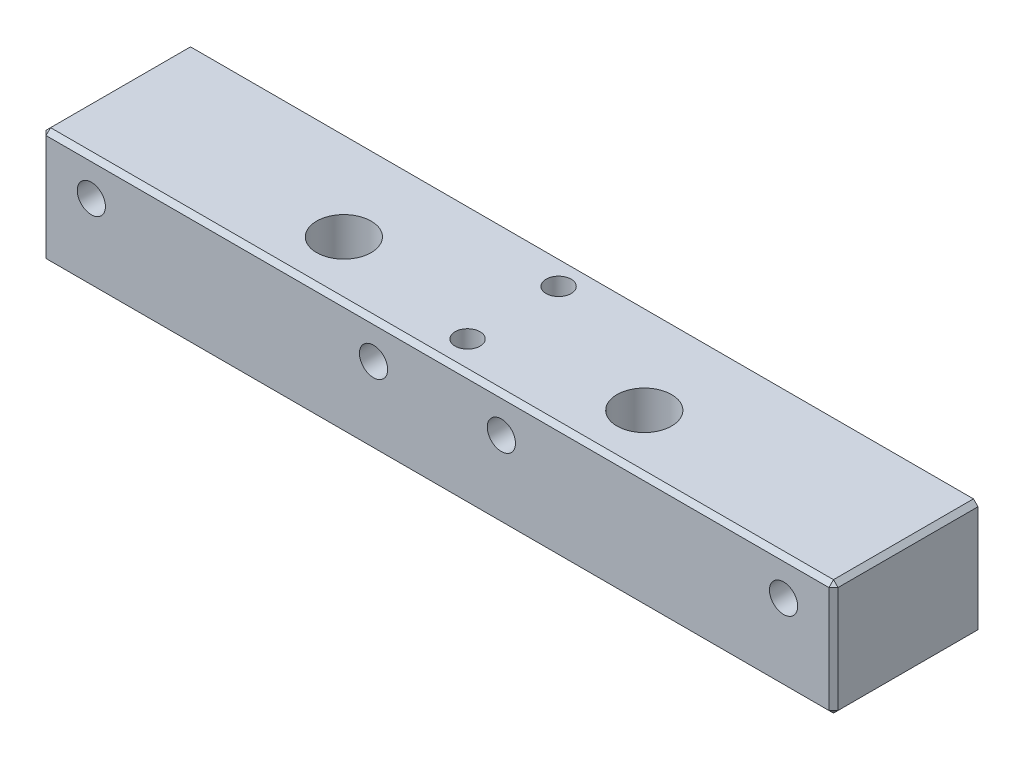
from build123d import *

# Parameters (mm, degrees)
SKETCH1_W           = 87
SKETCH1_H           = 12.7
BOSS_EXTRUDE1_DEPTH = 7.9375
SKETCH4_R           = 3
CUT_EXTRUDE2_DEPTH  = 47.005911645
SKETCH2_R           = 1.55
CUT_EXTRUDE1_DEPTH  = 47.739577715
CHAMFER3_SIZE       = 0.5
SKETCH5_R           = 1.375
CUT_EXTRUDE3_DEPTH  = 6
SKETCH6_R           = 1.375
CUT_EXTRUDE4_DEPTH  = 47.005911645


with BuildPart() as part:
    # Sketch1 → Boss-Extrude1 (new, symmetric)
    with BuildSketch(Plane.XY):
        Rectangle(SKETCH1_W, SKETCH1_H)
    extrude(amount=BOSS_EXTRUDE1_DEPTH, both=True)

    # Sketch4 → Cut-Extrude2 (cut, through all)
    with BuildSketch(Plane(origin=(0, 6.35, 0), x_dir=(1, 0, 0), z_dir=(0, 1, 0))):
        with Locations(Location((16.5, -1.7175, 0), (0, 0, 270))):
            Circle(SKETCH4_R)
        with Locations(Location((-16.5, -1.7175, 0), (0, 0, 270))):
            Circle(SKETCH4_R)
    extrude(amount=-CUT_EXTRUDE2_DEPTH, mode=Mode.SUBTRACT)

    # Sketch2 → Cut-Extrude1 (cut, through all)
    with BuildSketch(Plane.XY.offset(7.9375)):
        with Locations((-38.02, 2.35)):
            Circle(SKETCH2_R)
        with Locations((7.02, 2.35)):
            Circle(SKETCH2_R)
        with Locations((-7.02, 2.35)):
            Circle(SKETCH2_R)
        with Locations((38.02, 2.35)):
            Circle(SKETCH2_R)
    extrude(amount=-CUT_EXTRUDE1_DEPTH, mode=Mode.SUBTRACT)

    # Chamfer3
    chamfer3_edges = [part.edges().sort_by_distance(p)[0] for p in [
        (-43.5, 0, 7.9375),
        (0, -6.35, 7.9375),
        (43.5, 0, 7.9375),
        (0, 6.35, 7.9375),
        (43.5, -6.35, 0),
        (-43.5, -6.35, 0),
        (-43.5, 6.35, 0),
        (43.5, 6.35, 0),
    ]]
    chamfer(chamfer3_edges, length=CHAMFER3_SIZE)

    # Sketch5 → Cut-Extrude3 (cut)
    with BuildSketch(Plane(origin=(0, -6.35, 0), x_dir=(1, 0, 0), z_dir=(0, 1, 0))):
        with Locations(Location((-37, 0.3675, 0), (0, 0, 270))):
            Circle(SKETCH5_R)
        with Locations(Location((0, 5.3675, 0), (0, 0, 270))):
            Circle(SKETCH5_R)
        with Locations(Location((37, 0.3675, 0), (0, 0, 90))):
            Circle(SKETCH5_R)
        with Locations(Location((0, -4.6325, 0), (0, 0, 270))):
            Circle(SKETCH5_R)
    extrude(amount=CUT_EXTRUDE3_DEPTH, mode=Mode.SUBTRACT)

    # Sketch6 → Cut-Extrude4 (cut, through all)
    with BuildSketch(Plane.XZ.offset(6.35)):
        with Locations(Location((0, 4.6325, 0), (0, 0, 270))):
            Circle(SKETCH6_R)
        with Locations(Location((0, -5.3675, 0), (0, 0, 270))):
            Circle(SKETCH6_R)
    extrude(amount=-CUT_EXTRUDE4_DEPTH, mode=Mode.SUBTRACT)


solid = part.part
